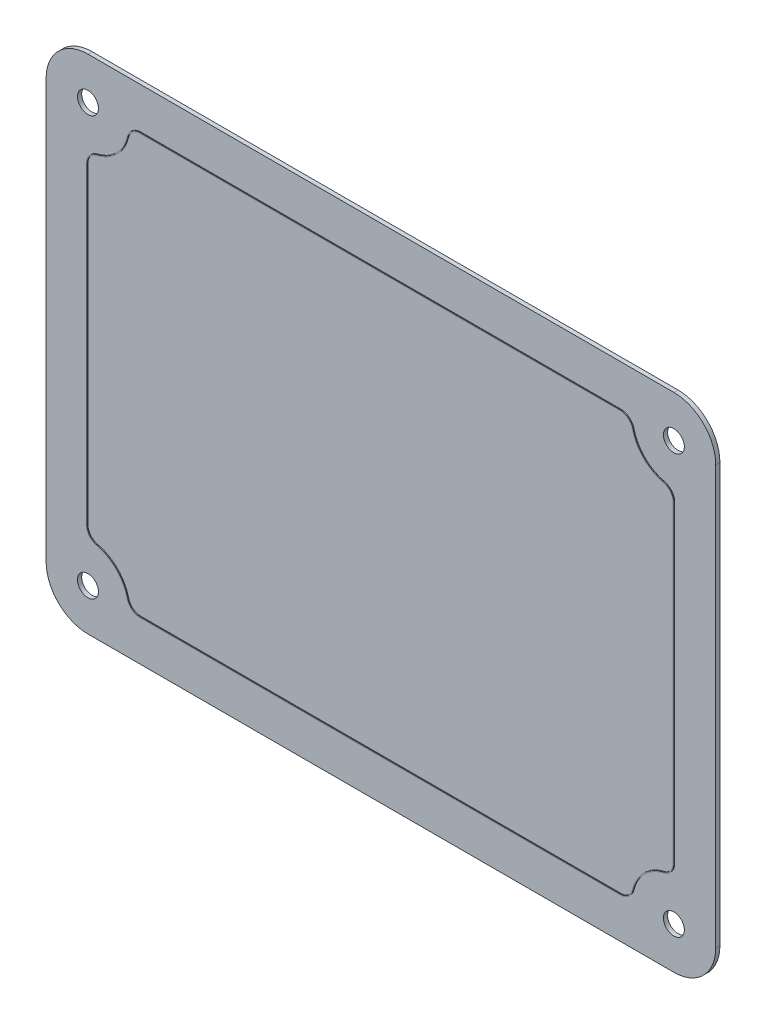
from build123d import *

# Parameters (mm, degrees)
SKETCH_1_R      = 1.25
EXTRUDE_1_DEPTH = 0.5
EXTRUDE_5_DEPTH = 0.1


with BuildPart() as part:
    # 草图1 → 凸台-拉伸1 (new body)
    with BuildSketch(Plane.XY):
        with BuildLine():
            Line((-35, 30), (35, 30))
            ThreePointArc((35, 30), (38.535533906, 28.535533906), (40, 25))
            Line((40, 25), (40, -25))
            ThreePointArc((40, -25), (38.535533906, -28.535533906), (35, -30))
            Line((35, -30), (-35, -30))
            ThreePointArc((-35, -30), (-38.535533906, -28.535533906), (-40, -25))
            Line((-40, -25), (-40, 25))
            ThreePointArc((-40, 25), (-38.535533906, 28.535533906), (-35, 30))
        make_face()
        with Locations((35, 25)):
            Circle(SKETCH_1_R, mode=Mode.SUBTRACT)
        with Locations((-35, 25)):
            Circle(SKETCH_1_R, mode=Mode.SUBTRACT)
        with Locations((-35, -25)):
            Circle(SKETCH_1_R, mode=Mode.SUBTRACT)
        with Locations((35, -25)):
            Circle(SKETCH_1_R, mode=Mode.SUBTRACT)
    extrude(amount=EXTRUDE_1_DEPTH)

    # 草图4 → 凸台-拉伸5 (add)
    with BuildSketch(Plane.XY.offset(0.5)):
        with BuildLine():
            Line((-28.67544468, 25.1), (28.67544468, 25.1))
            ThreePointArc((28.67544468, 25.1), (29.667722556, 24.755143265), (30.232258297, 23.869230769))
            ThreePointArc((30.232258297, 23.869230769), (31.535176772, 21.535176772), (33.869230769, 20.232258297))
            ThreePointArc((33.869230769, 20.232258297), (34.755143265, 19.667722556), (35.1, 18.67544468))
            Line((35.1, 18.67544468), (35.1, -18.67544468))
            ThreePointArc((35.1, -18.67544468), (34.755143265, -19.667722556), (33.869230769, -20.232258297))
            ThreePointArc((33.869230769, -20.232258297), (31.535176772, -21.535176772), (30.232258297, -23.869230769))
            ThreePointArc((30.232258297, -23.869230769), (29.667722556, -24.755143265), (28.67544468, -25.1))
            Line((28.67544468, -25.1), (-28.67544468, -25.1))
            ThreePointArc((-28.67544468, -25.1), (-29.667722556, -24.755143265), (-30.232258297, -23.869230769))
            ThreePointArc((-30.232258297, -23.869230769), (-31.535176772, -21.535176772), (-33.869230769, -20.232258297))
            ThreePointArc((-33.869230769, -20.232258297), (-34.755143265, -19.667722556), (-35.1, -18.67544468))
            Line((-35.1, -18.67544468), (-35.1, 18.67544468))
            ThreePointArc((-35.1, 18.67544468), (-34.755143265, 19.667722556), (-33.869230769, 20.232258297))
            ThreePointArc((-33.869230769, 20.232258297), (-31.535176772, 21.535176772), (-30.232258297, 23.869230769))
            ThreePointArc((-30.232258297, 23.869230769), (-29.667722556, 24.755143265), (-28.67544468, 25.1))
        make_face()
        with BuildLine():
            Line((-28.67544468, 25), (28.67544468, 25))
            ThreePointArc((28.67544468, 25), (29.605705189, 24.676696811), (30.134957446, 23.846153846))
            ThreePointArc((30.134957446, 23.846153846), (31.464466094, 21.464466094), (33.846153846, 20.134957446))
            ThreePointArc((33.846153846, 20.134957446), (34.676696811, 19.605705189), (35, 18.67544468))
            Line((35, 18.67544468), (35, -18.67544468))
            ThreePointArc((35, -18.67544468), (34.676696811, -19.605705189), (33.846153846, -20.134957446))
            ThreePointArc((33.846153846, -20.134957446), (31.464466094, -21.464466094), (30.134957446, -23.846153846))
            ThreePointArc((30.134957446, -23.846153846), (29.605705189, -24.676696811), (28.67544468, -25))
            Line((28.67544468, -25), (-28.67544468, -25))
            ThreePointArc((-28.67544468, -25), (-29.605705189, -24.676696811), (-30.134957446, -23.846153846))
            ThreePointArc((-30.134957446, -23.846153846), (-31.464466094, -21.464466094), (-33.846153846, -20.134957446))
            ThreePointArc((-33.846153846, -20.134957446), (-34.676696811, -19.605705189), (-35, -18.67544468))
            Line((-35, -18.67544468), (-35, 18.67544468))
            ThreePointArc((-35, 18.67544468), (-34.676696811, 19.605705189), (-33.846153846, 20.134957446))
            ThreePointArc((-33.846153846, 20.134957446), (-31.464466094, 21.464466094), (-30.134957446, 23.846153846))
            ThreePointArc((-30.134957446, 23.846153846), (-29.605705189, 24.676696811), (-28.67544468, 25))
        make_face(mode=Mode.SUBTRACT)
    extrude(amount=EXTRUDE_5_DEPTH)


solid = part.part
